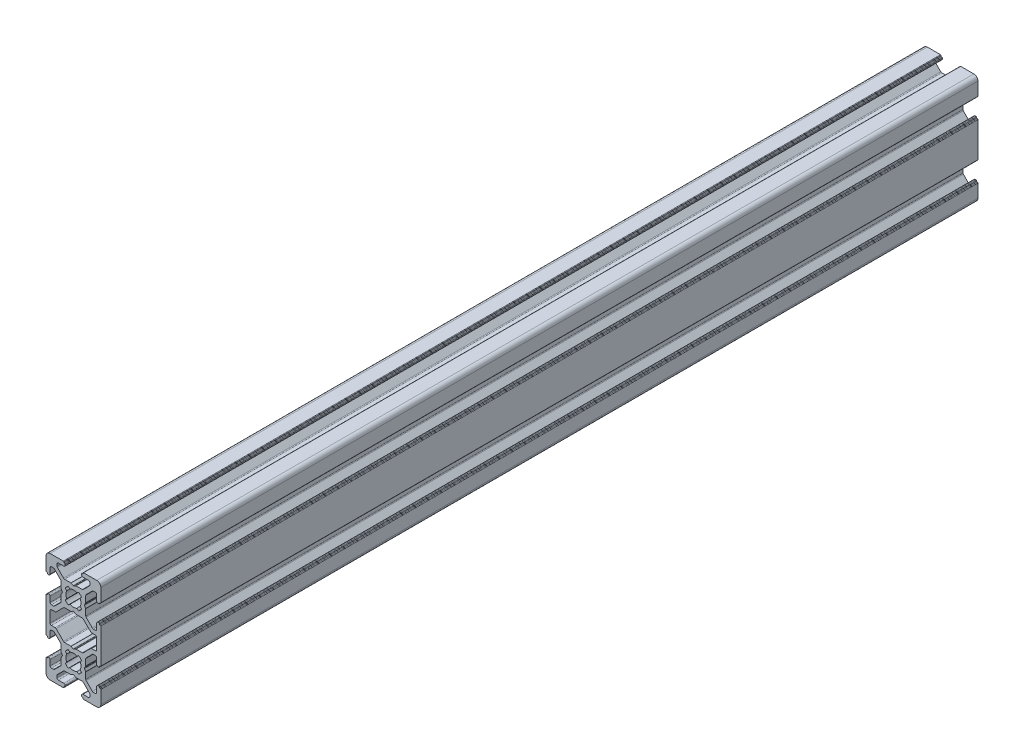
from build123d import *

# Parameters (mm, degrees)
EXTRUDE_1_DEPTH = 320


with BuildPart() as part:
    # 草图1 → 凸台-拉伸1 (new body)
    with BuildSketch(Plane.XY.offset(10)):
        with BuildLine():
            Line((6, 7.999999873), (6, 7.267766296))
            ThreePointArc((6, 7.267766296), (5.961940442, 7.076426211), (5.853555886, 6.914215401))
            Line((5.853555886, 6.914215401), (3.585869782, 4.646497282))
            ThreePointArc((3.585869782, 4.646497282), (3.423657243, 4.538109086), (3.232313896, 4.500048177))
            Line((3.232313896, 4.500048177), (0.9536741, 4.500048177))
            ThreePointArc((0.9536741, 4.500048177), (0.901910292, 4.493233342), (0.853674102, 4.473253259))
            Line((0.853674102, 4.473253259), (0.100000009, 4.03811933))
            ThreePointArc((0.100000009, 4.03811933), (-4e-09, 4.011324409), (-0.100000015, 4.038119334))
            Line((-0.100000015, 4.038119334), (-0.853674033, 4.473253255))
            ThreePointArc((-0.853674033, 4.473253255), (-0.901910226, 4.493233342), (-0.953674037, 4.500048177))
            Line((-0.953674037, 4.500048177), (-3.232313865, 4.500048177))
            ThreePointArc((-3.232313865, 4.500048177), (-3.423657211, 4.538109086), (-3.585869751, 4.646497282))
            Line((-3.585869751, 4.646497282), (-5.853555886, 6.914215433))
            ThreePointArc((-5.853555886, 6.914215433), (-5.961940442, 7.076426242), (-6, 7.267766328))
            Line((-6, 7.267766328), (-6, 8.000000007))
            ThreePointArc((-6, 8.000000007), (-5.853553391, 8.353553397), (-5.5, 8.500000007))
            Line((-5.5, 8.500000007), (-3.5, 8.500000007))
            ThreePointArc((-3.5, 8.500000007), (-3.146446609, 8.646446616), (-3, 9.000000007))
            Line((-3, 9.000000007), (-3, 9.3))
            ThreePointArc((-3, 9.3), (-3.058578644, 9.441421356), (-3.2, 9.5))
            Line((-3.2, 9.5), (-3.299999511, 9.5))
            ThreePointArc((-3.299999511, 9.5), (-3.441420868, 9.558578644), (-3.499999511, 9.7))
            Line((-3.499999511, 9.7), (-3.499999511, 9.8))
            ThreePointArc((-3.499999511, 9.8), (-3.558578155, 9.941421356), (-3.699999511, 10))
            Line((-3.699999511, 10), (-8.5, 10))
            ThreePointArc((-8.5, 10), (-9.560660172, 9.560660172), (-10, 8.5))
            Line((-10, 8.5), (-10, 3.699999824))
            ThreePointArc((-10, 3.699999824), (-9.941421356, 3.558578468), (-9.8, 3.499999824))
            Line((-9.8, 3.499999824), (-9.7, 3.499999824))
            ThreePointArc((-9.7, 3.499999824), (-9.558578644, 3.441421181), (-9.5, 3.299999824))
            Line((-9.5, 3.299999824), (-9.5, 3.200000176))
            ThreePointArc((-9.5, 3.200000176), (-9.441421356, 3.058578819), (-9.3, 3.000000176))
            Line((-9.3, 3.000000176), (-9.00000049, 3.000000176))
            ThreePointArc((-9.00000049, 3.000000176), (-8.6464471, 3.146446785), (-8.50000049, 3.500000176))
            Line((-8.50000049, 3.500000176), (-8.50000049, 5.550000042))
            ThreePointArc((-8.50000049, 5.550000042), (-8.353553842, 5.903553527), (-8.000000356, 6.050000176))
            Line((-8.000000356, 6.050000176), (-7.317766738, 6.050000176))
            ThreePointArc((-7.317766738, 6.050000176), (-7.126424828, 6.011939862), (-6.964213052, 5.903553271))
            Line((-6.964213052, 5.903553271), (-4.646446985, 3.58578333))
            ThreePointArc((-4.646446985, 3.58578333), (-4.538060825, 3.423571758), (-4.500000671, 3.232230235))
            Line((-4.500000671, 3.232230235), (-4.500000671, 0.953590513))
            ThreePointArc((-4.500000671, 0.953590513), (-4.493185837, 0.901826705), (-4.473205753, 0.853590515))
            Line((-4.473205753, 0.853590515), (-4.038120185, 0.100000185))
            ThreePointArc((-4.038120185, 0.100000185), (-4.011325264, 1.72e-07), (-4.038120188, -0.09999984))
            Line((-4.038120188, -0.09999984), (-4.47320575, -0.853590095))
            ThreePointArc((-4.47320575, -0.853590095), (-4.493185836, -0.901826288), (-4.500000671, -0.953590099))
            Line((-4.500000671, -0.953590099), (-4.500000671, -3.232230671))
            ThreePointArc((-4.500000671, -3.232230671), (-4.53806083, -3.423572205), (-4.646447002, -3.585783783))
            Line((-4.646447002, -3.585783783), (-6.864212665, -5.803552937))
            ThreePointArc((-6.864212665, -5.803552937), (-7.026424436, -5.911939515), (-7.217766334, -5.949999824))
            Line((-7.217766334, -5.949999824), (-8.00000049, -5.949999824))
            ThreePointArc((-8.00000049, -5.949999824), (-8.353553881, -5.803553215), (-8.50000049, -5.449999824))
            Line((-8.50000049, -5.449999824), (-8.50000049, -3.499999824))
            ThreePointArc((-8.50000049, -3.499999824), (-8.6464471, -3.146446434), (-9.00000049, -2.999999824))
            Line((-9.00000049, -2.999999824), (-9.3, -2.999999824))
            ThreePointArc((-9.3, -2.999999824), (-9.441421356, -3.058578468), (-9.5, -3.199999824))
            Line((-9.5, -3.199999824), (-9.5, -3.3))
            ThreePointArc((-9.5, -3.3), (-9.558578644, -3.441421356), (-9.7, -3.5))
            Line((-9.7, -3.5), (-9.8, -3.5))
            ThreePointArc((-9.8, -3.5), (-9.941421356, -3.558578644), (-10, -3.7))
            Line((-10, -3.7), (-10, -16.349999685))
            ThreePointArc((-10, -16.349999685), (-9.941421356, -16.491421041), (-9.8, -16.549999685))
            Line((-9.8, -16.549999685), (-9.7, -16.549999685))
            ThreePointArc((-9.7, -16.549999685), (-9.558578644, -16.608578329), (-9.5, -16.749999685))
            Line((-9.5, -16.749999685), (-9.5, -16.849999824))
            ThreePointArc((-9.5, -16.849999824), (-9.441421356, -16.991421181), (-9.3, -17.049999824))
            Line((-9.3, -17.049999824), (-9.00000049, -17.049999824))
            ThreePointArc((-9.00000049, -17.049999824), (-8.6464471, -16.903553215), (-8.50000049, -16.549999824))
            Line((-8.50000049, -16.549999824), (-8.50000049, -14.500000348))
            ThreePointArc((-8.50000049, -14.500000348), (-8.353553881, -14.146446958), (-8.00000049, -14.000000348))
            Line((-8.00000049, -14.000000348), (-7.267765653, -14.000000348))
            ThreePointArc((-7.267765653, -14.000000348), (-7.076423755, -14.038060657), (-6.914211984, -14.146447236))
            Line((-6.914211984, -14.146447236), (-4.646447002, -16.414215787))
            ThreePointArc((-4.646447002, -16.414215787), (-4.53806083, -16.576427365), (-4.500000671, -16.767768899))
            Line((-4.500000671, -16.767768899), (-4.500000671, -19.04640955))
            ThreePointArc((-4.500000671, -19.04640955), (-4.493185836, -19.098173361), (-4.47320575, -19.146409554))
            Line((-4.47320575, -19.146409554), (-4.038120188, -19.899999809))
            ThreePointArc((-4.038120188, -19.899999809), (-4.011325264, -19.999999821), (-4.038120185, -20.099999833))
            Line((-4.038120185, -20.099999833), (-4.473205753, -20.853590164))
            ThreePointArc((-4.473205753, -20.853590164), (-4.493185837, -20.901826354), (-4.500000671, -20.953590162))
            Line((-4.500000671, -20.953590162), (-4.500000671, -23.232229884))
            ThreePointArc((-4.500000671, -23.232229884), (-4.538060825, -23.423571407), (-4.646446985, -23.585782979))
            Line((-4.646446985, -23.585782979), (-6.914213659, -25.853553443))
            ThreePointArc((-6.914213659, -25.853553443), (-7.076425436, -25.961940035), (-7.267767345, -26.000000348))
            Line((-7.267767345, -26.000000348), (-8.000000356, -26.000000348))
            ThreePointArc((-8.000000356, -26.000000348), (-8.353553842, -25.8535537), (-8.50000049, -25.500000214))
            Line((-8.50000049, -25.500000214), (-8.50000049, -23.549999824))
            ThreePointArc((-8.50000049, -23.549999824), (-8.6464471, -23.196446434), (-9.00000049, -23.049999824))
            Line((-9.00000049, -23.049999824), (-9.3, -23.049999824))
            ThreePointArc((-9.3, -23.049999824), (-9.441421356, -23.108578468), (-9.5, -23.249999824))
            Line((-9.5, -23.249999824), (-9.5, -23.349999824))
            ThreePointArc((-9.5, -23.349999824), (-9.558578644, -23.491421181), (-9.7, -23.549999824))
            Line((-9.7, -23.549999824), (-9.8, -23.549999824))
            ThreePointArc((-9.8, -23.549999824), (-9.941421356, -23.608578468), (-10, -23.749999824))
            Line((-10, -23.749999824), (-10, -28.5))
            ThreePointArc((-10, -28.5), (-9.560660172, -29.560660172), (-8.5, -30))
            Line((-8.5, -30), (-3.69999951, -30))
            ThreePointArc((-3.69999951, -30), (-3.558578153, -29.941421356), (-3.49999951, -29.8))
            Line((-3.49999951, -29.8), (-3.49999951, -29.7))
            ThreePointArc((-3.49999951, -29.7), (-3.441420866, -29.558578644), (-3.29999951, -29.5))
            Line((-3.29999951, -29.5), (-3.2, -29.5))
            ThreePointArc((-3.2, -29.5), (-3.058578644, -29.441421356), (-3, -29.3))
            Line((-3, -29.3), (-3, -29.000000007))
            ThreePointArc((-3, -29.000000007), (-3.146446609, -28.646446616), (-3.5, -28.500000007))
            Line((-3.5, -28.500000007), (-5.5, -28.500000007))
            ThreePointArc((-5.5, -28.500000007), (-5.853553391, -28.353553397), (-6, -28.000000007))
            Line((-6, -28.000000007), (-6, -27.267766328))
            ThreePointArc((-6, -27.267766328), (-5.961939756, -27.076424587), (-5.853553353, -26.914212899))
            Line((-5.853553353, -26.914212899), (-3.585786596, -24.646446628))
            ThreePointArc((-3.585786596, -24.646446628), (-3.423574935, -24.53806028), (-3.232233243, -24.500000057))
            Line((-3.232233243, -24.500000057), (-0.953593447, -24.500000057))
            ThreePointArc((-0.953593447, -24.500000057), (-0.901829637, -24.493185222), (-0.853593445, -24.473205136))
            Line((-0.853593445, -24.473205136), (-0.100000013, -24.038117753))
            ThreePointArc((-0.100000013, -24.038117753), (0, -24.011322829), (0.100000013, -24.038117753))
            Line((0.100000013, -24.038117753), (0.853593445, -24.473205136))
            ThreePointArc((0.853593445, -24.473205136), (0.901829637, -24.493185222), (0.953593447, -24.500000057))
            Line((0.953593447, -24.500000057), (3.232233243, -24.500000057))
            ThreePointArc((3.232233243, -24.500000057), (3.423574935, -24.53806028), (3.585786596, -24.646446628))
            Line((3.585786596, -24.646446628), (5.853553353, -26.914212899))
            ThreePointArc((5.853553353, -26.914212899), (5.961939756, -27.076424587), (6, -27.267766328))
            Line((6, -27.267766328), (6, -27.999999873))
            ThreePointArc((6, -27.999999873), (5.853553351, -28.353553358), (5.499999866, -28.500000007))
            Line((5.499999866, -28.500000007), (3.50000049, -28.500000007))
            ThreePointArc((3.50000049, -28.500000007), (3.1464471, -28.646446616), (3.00000049, -29.000000007))
            Line((3.00000049, -29.000000007), (3.00000049, -29.3))
            ThreePointArc((3.00000049, -29.3), (3.058579134, -29.441421356), (3.20000049, -29.5))
            Line((3.20000049, -29.5), (3.30000049, -29.5))
            ThreePointArc((3.30000049, -29.5), (3.441421847, -29.558578644), (3.50000049, -29.7))
            Line((3.50000049, -29.7), (3.50000049, -29.8))
            ThreePointArc((3.50000049, -29.8), (3.558579134, -29.941421356), (3.70000049, -30))
            Line((3.70000049, -30), (8.500000461, -30))
            ThreePointArc((8.500000461, -30), (9.560660307, -29.560660307), (10, -28.500000461))
            Line((10, -28.500000461), (10, -23.749999824))
            ThreePointArc((10, -23.749999824), (9.941421356, -23.608578468), (9.8, -23.549999824))
            Line((9.8, -23.549999824), (9.699998596, -23.549999824))
            ThreePointArc((9.699998596, -23.549999824), (9.55857724, -23.491421181), (9.499998596, -23.349999824))
            Line((9.499998596, -23.349999824), (9.499998596, -23.249999824))
            ThreePointArc((9.499998596, -23.249999824), (9.441419952, -23.108578468), (9.299998596, -23.049999824))
            Line((9.299998596, -23.049999824), (8.999999086, -23.049999824))
            ThreePointArc((8.999999086, -23.049999824), (8.646445696, -23.196446434), (8.499999086, -23.549999824))
            Line((8.499999086, -23.549999824), (8.499999086, -25.500000348))
            ThreePointArc((8.499999086, -25.500000348), (8.353552477, -25.853553739), (7.999999086, -26.000000348))
            Line((7.999999086, -26.000000348), (7.267766467, -26.000000348))
            ThreePointArc((7.267766467, -26.000000348), (7.076424558, -25.961940035), (6.914212781, -25.853553443))
            Line((6.914212781, -25.853553443), (4.646446283, -23.585783155))
            ThreePointArc((4.646446283, -23.585783155), (4.538060123, -23.423571583), (4.499999969, -23.23223006))
            Line((4.499999969, -23.23223006), (4.499999969, -20.953590264))
            ThreePointArc((4.499999969, -20.953590264), (4.493185135, -20.901826456), (4.473205051, -20.853590266))
            Line((4.473205051, -20.853590266), (4.038119525, -20.100000009))
            ThreePointArc((4.038119525, -20.100000009), (4.011324604, -20.000000005), (4.03811952, -19.899999999))
            Line((4.03811952, -19.899999999), (4.473205056, -19.146409641))
            ThreePointArc((4.473205056, -19.146409641), (4.493185136, -19.098173455), (4.499999969, -19.046409652))
            Line((4.499999969, -19.046409652), (4.499999969, -16.767769856))
            ThreePointArc((4.499999969, -16.767769856), (4.538060128, -16.576428321), (4.6464463, -16.414216743))
            Line((4.6464463, -16.414216743), (6.914212238, -14.146447236))
            ThreePointArc((6.914212238, -14.146447236), (7.076424009, -14.038060657), (7.267765907, -14.000000348))
            Line((7.267765907, -14.000000348), (7.999998952, -14.000000348))
            ThreePointArc((7.999998952, -14.000000348), (8.353552437, -14.146446997), (8.499999086, -14.500000482))
            Line((8.499999086, -14.500000482), (8.499999086, -16.549999824))
            ThreePointArc((8.499999086, -16.549999824), (8.646445696, -16.903553215), (8.999999086, -17.049999824))
            Line((8.999999086, -17.049999824), (9.299998596, -17.049999824))
            ThreePointArc((9.299998596, -17.049999824), (9.441419952, -16.991421181), (9.499998596, -16.849999824))
            Line((9.499998596, -16.849999824), (9.499998596, -16.749999685))
            ThreePointArc((9.499998596, -16.749999685), (9.55857724, -16.608578329), (9.699998596, -16.549999685))
            Line((9.699998596, -16.549999685), (9.8, -16.549999685))
            ThreePointArc((9.8, -16.549999685), (9.941421356, -16.491421041), (10, -16.349999685))
            Line((10, -16.349999685), (10, -3.699999824))
            ThreePointArc((10, -3.699999824), (9.941421356, -3.558578468), (9.8, -3.499999824))
            Line((9.8, -3.499999824), (9.699998596, -3.499999824))
            ThreePointArc((9.699998596, -3.499999824), (9.55857724, -3.441421181), (9.499998596, -3.299999824))
            Line((9.499998596, -3.299999824), (9.499998596, -3.199999824))
            ThreePointArc((9.499998596, -3.199999824), (9.441419952, -3.058578468), (9.299998596, -2.999999824))
            Line((9.299998596, -2.999999824), (8.999999086, -2.999999824))
            ThreePointArc((8.999999086, -2.999999824), (8.646445696, -3.146446434), (8.499999086, -3.499999824))
            Line((8.499999086, -3.499999824), (8.499999086, -5.500000605))
            ThreePointArc((8.499999086, -5.500000605), (8.353552437, -5.85355409), (7.999998952, -6.000000739))
            Line((7.999998952, -6.000000739), (7.267766994, -6.000000739))
            ThreePointArc((7.267766994, -6.000000739), (7.076425096, -5.96194043), (6.914213325, -5.853553851))
            Line((6.914213325, -5.853553851), (4.6464463, -3.585783257))
            ThreePointArc((4.6464463, -3.585783257), (4.538060128, -3.423571679), (4.499999969, -3.232230144))
            Line((4.499999969, -3.232230144), (4.499999969, -0.953590348))
            ThreePointArc((4.499999969, -0.953590348), (4.493185136, -0.901826545), (4.473205056, -0.853590359))
            Line((4.473205056, -0.853590359), (4.03811952, -0.100000001))
            ThreePointArc((4.03811952, -0.100000001), (4.011324604, 5e-09), (4.038119525, 0.100000009))
            Line((4.038119525, 0.100000009), (4.473205051, 0.853590266))
            ThreePointArc((4.473205051, 0.853590266), (4.493185135, 0.901826456), (4.499999969, 0.953590264))
            Line((4.499999969, 0.953590264), (4.499999969, 3.23223006))
            ThreePointArc((4.499999969, 3.23223006), (4.538060123, 3.423571583), (4.646446283, 3.585783155))
            Line((4.646446283, 3.585783155), (6.914211695, 5.853552357))
            ThreePointArc((6.914211695, 5.853552357), (7.076423471, 5.961938948), (7.267765381, 5.999999261))
            Line((7.267765381, 5.999999261), (7.999999086, 5.999999261))
            ThreePointArc((7.999999086, 5.999999261), (8.353552477, 5.853552652), (8.499999086, 5.499999261))
            Line((8.499999086, 5.499999261), (8.499999086, 3.500000176))
            ThreePointArc((8.499999086, 3.500000176), (8.646445696, 3.146446785), (8.999999086, 3.000000176))
            Line((8.999999086, 3.000000176), (9.299998596, 3.000000176))
            ThreePointArc((9.299998596, 3.000000176), (9.441419952, 3.058578819), (9.499998596, 3.200000176))
            Line((9.499998596, 3.200000176), (9.499998596, 3.300000176))
            ThreePointArc((9.499998596, 3.300000176), (9.55857724, 3.441421532), (9.699998596, 3.500000176))
            Line((9.699998596, 3.500000176), (9.8, 3.500000176))
            ThreePointArc((9.8, 3.500000176), (9.941421356, 3.558578819), (10, 3.700000176))
            Line((10, 3.700000176), (10, 8.500000027))
            ThreePointArc((10, 8.500000027), (9.56066018, 9.56066018), (8.500000027, 10))
            Line((8.500000027, 10), (3.700000258, 10))
            ThreePointArc((3.700000258, 10), (3.558578902, 9.941421356), (3.500000258, 9.8))
            Line((3.500000258, 9.8), (3.500000258, 9.7))
            ThreePointArc((3.500000258, 9.7), (3.441421614, 9.558578644), (3.300000258, 9.5))
            Line((3.300000258, 9.5), (3.20000049, 9.5))
            ThreePointArc((3.20000049, 9.5), (3.058579134, 9.441421356), (3.00000049, 9.3))
            Line((3.00000049, 9.3), (3.00000049, 9.000000007))
            ThreePointArc((3.00000049, 9.000000007), (3.1464471, 8.646446616), (3.50000049, 8.500000007))
            Line((3.50000049, 8.500000007), (5.499999866, 8.500000007))
            ThreePointArc((5.499999866, 8.500000007), (5.853553351, 8.353553358), (6, 7.999999873))
        make_face()
        with BuildLine():
            Line((2.947715037, 1.887054865), (2.445295423, 1.258185317))
            ThreePointArc((2.445295423, 1.258185317), (2.75, -6.7e-08), (2.445295362, -1.258185436))
            Line((2.445295362, -1.258185436), (2.947714945, -1.887055008))
            ThreePointArc((2.947714945, -1.887055008), (2.474873674, -2.474873794), (1.887054865, -2.947715037))
            Line((1.887054865, -2.947715037), (1.258185317, -2.445295423))
            ThreePointArc((1.258185317, -2.445295423), (-6.7e-08, -2.75), (-1.258185436, -2.445295362))
            Line((-1.258185436, -2.445295362), (-1.887055008, -2.947714945))
            ThreePointArc((-1.887055008, -2.947714945), (-2.474873794, -2.474873674), (-2.947715037, -1.887054865))
            Line((-2.947715037, -1.887054865), (-2.445295423, -1.258185317))
            ThreePointArc((-2.445295423, -1.258185317), (-2.75, 6.7e-08), (-2.445295362, 1.258185436))
            Line((-2.445295362, 1.258185436), (-2.947714945, 1.887055008))
            ThreePointArc((-2.947714945, 1.887055008), (-2.474873674, 2.474873794), (-1.887054865, 2.947715037))
            Line((-1.887054865, 2.947715037), (-1.258185317, 2.445295423))
            ThreePointArc((-1.258185317, 2.445295423), (6.7e-08, 2.75), (1.258185436, 2.445295362))
            Line((1.258185436, 2.445295362), (1.887055008, 2.947714945))
            ThreePointArc((1.887055008, 2.947714945), (2.474873794, 2.474873674), (2.947715037, 1.887054865))
        make_face(mode=Mode.SUBTRACT)
        with BuildLine():
            Line((2.947714945, -18.112944992), (2.445295362, -18.741814564))
            ThreePointArc((2.445295362, -18.741814564), (2.75, -19.999999933), (2.445295423, -21.258185317))
            Line((2.445295423, -21.258185317), (2.947715037, -21.887054865))
            ThreePointArc((2.947715037, -21.887054865), (2.474873794, -22.474873674), (1.887055008, -22.947714945))
            Line((1.887055008, -22.947714945), (1.258185436, -22.445295362))
            ThreePointArc((1.258185436, -22.445295362), (6.7e-08, -22.75), (-1.258185317, -22.445295423))
            Line((-1.258185317, -22.445295423), (-1.887054865, -22.947715037))
            ThreePointArc((-1.887054865, -22.947715037), (-2.474873674, -22.474873794), (-2.947714945, -21.887055008))
            Line((-2.947714945, -21.887055008), (-2.445295362, -21.258185436))
            ThreePointArc((-2.445295362, -21.258185436), (-2.75, -20.000000067), (-2.445295423, -18.741814683))
            Line((-2.445295423, -18.741814683), (-2.947715037, -18.112945135))
            ThreePointArc((-2.947715037, -18.112945135), (-2.474873794, -17.525126326), (-1.887055008, -17.052285055))
            Line((-1.887055008, -17.052285055), (-1.258185436, -17.554704638))
            ThreePointArc((-1.258185436, -17.554704638), (-6.7e-08, -17.25), (1.258185317, -17.554704577))
            Line((1.258185317, -17.554704577), (1.887054865, -17.052284963))
            ThreePointArc((1.887054865, -17.052284963), (2.474873674, -17.525126206), (2.947714945, -18.112944992))
        make_face(mode=Mode.SUBTRACT)
        with BuildLine():
            Line((-0.953786589, -15.499886919), (-3.232426354, -15.499886919))
            ThreePointArc((-3.232426354, -15.499886919), (-3.423771436, -15.461825291), (-3.585984897, -15.353435158))
            Line((-3.585984897, -15.353435158), (-6.292889573, -12.646451586))
            ThreePointArc((-6.292889573, -12.646451586), (-6.455103034, -12.538061452), (-6.646448116, -12.499999824))
            Line((-6.646448116, -12.499999824), (-8.00000049, -12.499999824))
            ThreePointArc((-8.00000049, -12.499999824), (-8.353553881, -12.353553215), (-8.50000049, -11.999999824))
            Line((-8.50000049, -11.999999824), (-8.50000049, -7.999999824))
            ThreePointArc((-8.50000049, -7.999999824), (-8.353553881, -7.646446434), (-8.00000049, -7.499999824))
            Line((-8.00000049, -7.499999824), (-6.646448116, -7.499999824))
            ThreePointArc((-6.646448116, -7.499999824), (-6.455106223, -7.461939518), (-6.292894455, -7.353552945))
            Line((-6.292894455, -7.353552945), (-3.58580313, -4.646457485))
            ThreePointArc((-3.58580313, -4.646457485), (-3.423591362, -4.538070912), (-3.232249469, -4.500010605))
            Line((-3.232249469, -4.500010605), (-0.953609705, -4.500010605))
            ThreePointArc((-0.953609705, -4.500010605), (-0.901845897, -4.493195771), (-0.853609707, -4.473215687))
            Line((-0.853609707, -4.473215687), (-0.100000711, -4.038119342))
            ThreePointArc((-0.100000711, -4.038119342), (-6.98e-07, -4.011324421), (0.099999313, -4.038119346))
            Line((0.099999313, -4.038119346), (0.853608234, -4.473215684))
            ThreePointArc((0.853608234, -4.473215684), (0.901844427, -4.49319577), (0.953608238, -4.500010605))
            Line((0.953608238, -4.500010605), (3.232248034, -4.500010605))
            ThreePointArc((3.232248034, -4.500010605), (3.423589927, -4.538070912), (3.585801695, -4.646457485))
            Line((3.585801695, -4.646457485), (6.292893019, -7.353552945))
            ThreePointArc((6.292893019, -7.353552945), (6.455104788, -7.461939518), (6.64644668, -7.499999824))
            Line((6.64644668, -7.499999824), (7.999999086, -7.499999824))
            ThreePointArc((7.999999086, -7.499999824), (8.353552477, -7.646446434), (8.499999086, -7.999999824))
            Line((8.499999086, -7.999999824), (8.499999086, -11.999999824))
            ThreePointArc((8.499999086, -11.999999824), (8.353552477, -12.353553215), (7.999999086, -12.499999824))
            Line((7.999999086, -12.499999824), (6.64644668, -12.499999824))
            ThreePointArc((6.64644668, -12.499999824), (6.455101598, -12.538061452), (6.292888137, -12.646451586))
            Line((6.292888137, -12.646451586), (3.585983461, -15.353435158))
            ThreePointArc((3.585983461, -15.353435158), (3.423770001, -15.461825291), (3.232424918, -15.499886919))
            Line((3.232424918, -15.499886919), (0.953785122, -15.499886919))
            ThreePointArc((0.953785122, -15.499886919), (0.902021311, -15.506701755), (0.853785118, -15.526681841))
            Line((0.853785118, -15.526681841), (0.099999313, -15.961880303))
            ThreePointArc((0.099999313, -15.961880303), (-6.98e-07, -15.988675228), (-0.100000711, -15.961880307))
            Line((-0.100000711, -15.961880307), (-0.853786591, -15.526681837))
            ThreePointArc((-0.853786591, -15.526681837), (-0.902022782, -15.506701754), (-0.953786589, -15.499886919))
        make_face(mode=Mode.SUBTRACT)
    extrude(amount=-EXTRUDE_1_DEPTH)


solid = part.part
